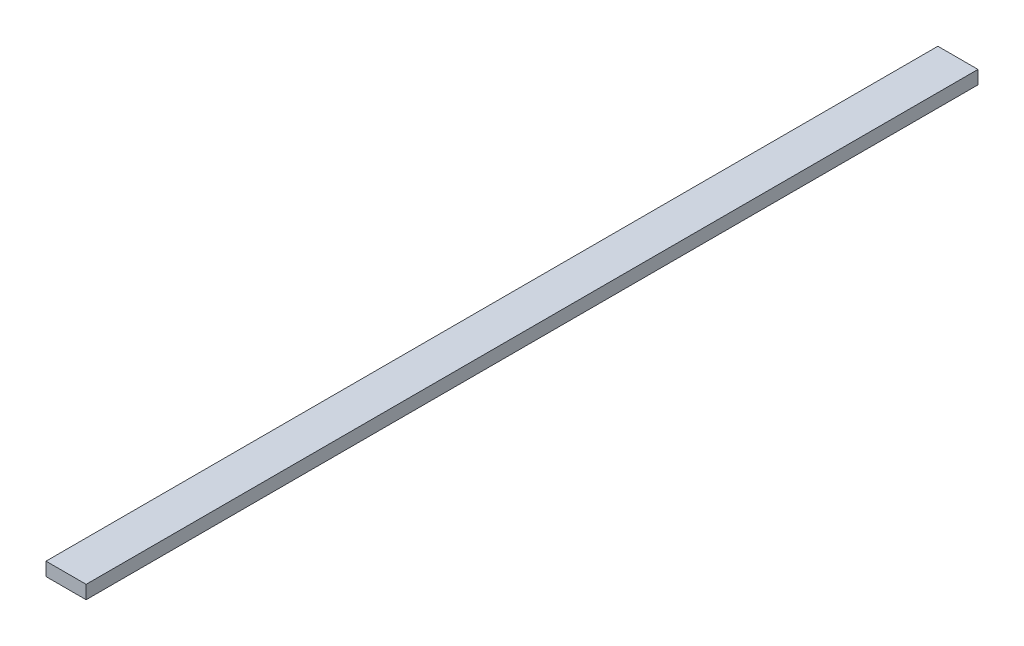
from build123d import *

# Parameters (mm, degrees)
SKETCH1_W           = 4.5
SKETCH1_H           = 1.5
BOSS_EXTRUDE2_DEPTH = 100


with BuildPart() as part:
    # Sketch1 → Boss-Extrude2 (new body)
    with BuildSketch(Plane.XY):
        with Locations((2.25, 0.75)):
            Rectangle(SKETCH1_W, SKETCH1_H)
    extrude(amount=BOSS_EXTRUDE2_DEPTH)


solid = part.part
